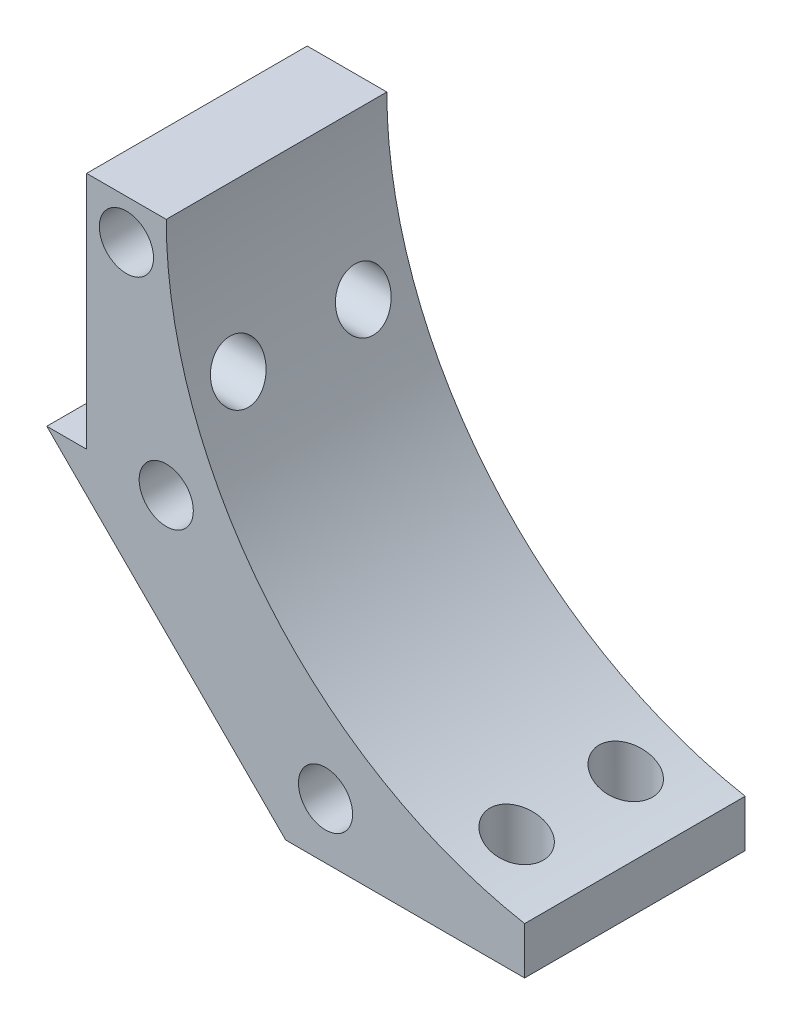
from build123d import *

# Parameters (mm, degrees)
SKETCH_1_W          = 30
SKETCH_1_H          = 30
SKETCH_1_W_2        = 25
EXTRUDE_1_DEPTH     = 27.7
SKETCH_3_R          = 55
CUT_EXTRUDE_1_DEPTH = 40
SKETCH_4_R          = 3.4
CUT_EXTRUDE_2_DEPTH = 90.259677346
SKETCH_5_R          = 3.3
CUT_EXTRUDE_3_DEPTH = 86.978427527
SKETCH_6_R          = 3.35
CUT_EXTRUDE_4_DEPTH = 90.259677512


with BuildPart() as part:
    # 草图1 → 凸台-拉伸1 (new body)
    with BuildSketch(Plane.XY):
        Polygon((0, 30), (30, 0), (30, 30), align=None)
        with Locations((45, 15)):
            Rectangle(SKETCH_1_W, SKETCH_1_H)
        with Locations((17.5, 45)):
            Rectangle(SKETCH_1_W_2, SKETCH_1_H)
    extrude(amount=EXTRUDE_1_DEPTH)

    # 草图3 → 切除-拉伸1 (cut)
    with BuildSketch(Plane.XY.offset(27.7)):
        with Locations((70, 60)):
            Circle(SKETCH_3_R)
    extrude(amount=-CUT_EXTRUDE_1_DEPTH, mode=Mode.SUBTRACT)

    # 草图4 → 切除-拉伸2 (cut, through all)
    with BuildSketch(Plane.XY.offset(27.7)):
        with Locations((35, 7)):
            Circle(SKETCH_4_R)
        with Locations((10, 55)):
            Circle(SKETCH_4_R)
        with Locations((15, 30)):
            Circle(SKETCH_4_R)
    extrude(amount=-CUT_EXTRUDE_2_DEPTH, mode=Mode.SUBTRACT)

    # 草图5 → 切除-拉伸3 (cut, through all)
    with BuildSketch(Plane.ZY.offset(-5)):
        with Locations(Location((6, 42, 0), (0, 0, 270))):
            Circle(SKETCH_5_R)
        with Locations(Location((21.7, 42, 0), (0, 0, 270))):
            Circle(SKETCH_5_R)
    extrude(amount=-CUT_EXTRUDE_3_DEPTH, mode=Mode.SUBTRACT)

    # 草图6 → 切除-拉伸4 (cut, through all)
    with BuildSketch(Plane.XZ):
        with Locations(Location((52, 20.7, 0), (0, 0, 270))):
            Circle(SKETCH_6_R)
        with Locations(Location((52, 7, 0), (0, 0, 270))):
            Circle(SKETCH_6_R)
    extrude(amount=-CUT_EXTRUDE_4_DEPTH, mode=Mode.SUBTRACT)


solid = part.part
